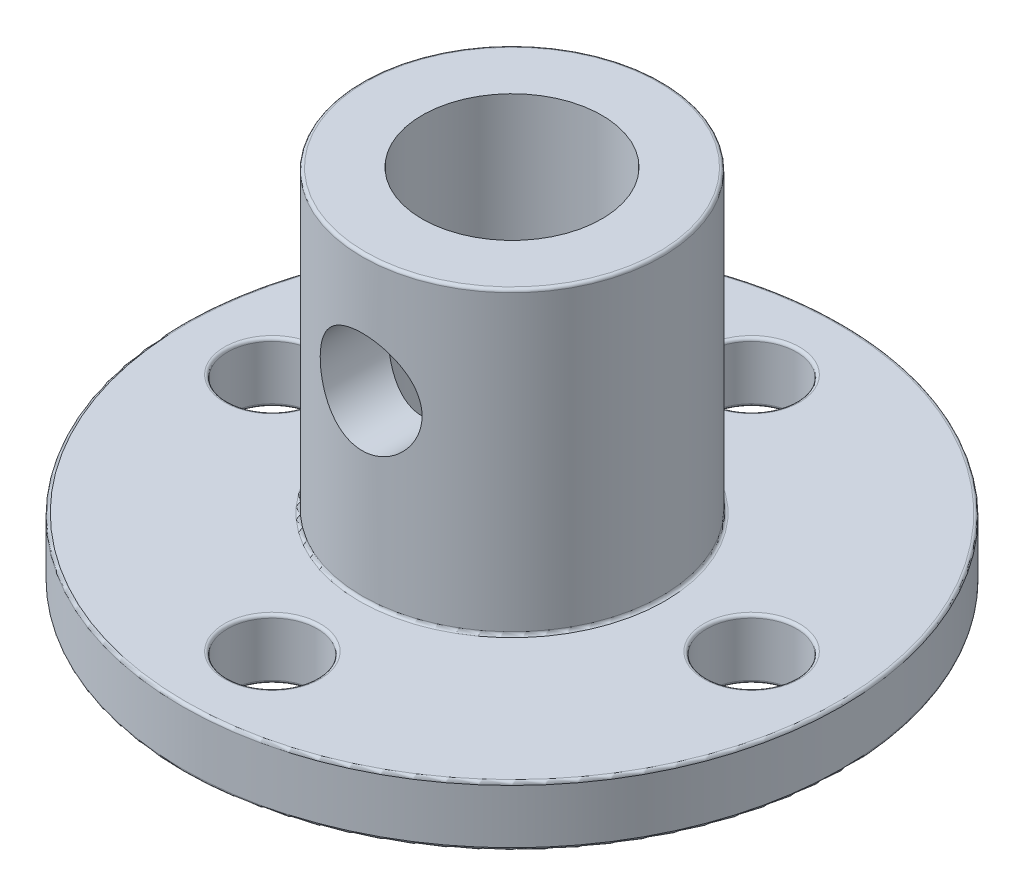
from build123d import *

# Parameters (mm, degrees)
SKETCH2_R                 = 11
BOSS_EXTRUDE1_DEPTH       = 2
SKETCH3_R                 = 5
BOSS_EXTRUDE2_DEPTH       = 10
SKETCH4_R                 = 3
CUT_EXTRUDE1_DEPTH        = 20.646882704
SKETCH5_R                 = 1.5
CUT_EXTRUDE2_DEPTH        = 19.493242009
FILLET1_R                 = 0.1
M3_CLEARANCE_HOLE1_REACH  = 24.825
M3_CLEARANCE_HOLE1_BORE_R = 1.7


with BuildPart() as part:
    # Sketch2 → Boss-Extrude1 (new body)
    with BuildSketch(Plane(origin=(0, 0, 0), x_dir=(1, 0, 0), z_dir=(0, 1, 0))):
        with Locations(Location((0, 0, 0), (0, 0, 270))):
            Circle(SKETCH2_R)
    extrude(amount=BOSS_EXTRUDE1_DEPTH)

    # Sketch3 → Boss-Extrude2 (add)
    with BuildSketch(Plane(origin=(0, 2, 0), x_dir=(1, 0, 0), z_dir=(0, 1, 0))):
        with Locations(Location((0, 0, 0), (0, 0, 270))):
            Circle(SKETCH3_R)
    extrude(amount=BOSS_EXTRUDE2_DEPTH)

    # Sketch4 → Cut-Extrude1 (cut, through all)
    with BuildSketch(Plane(origin=(0, 12, 0), x_dir=(1, 0, 0), z_dir=(0, 1, 0))):
        with Locations(Location((0, 0, 0), (0, 0, 270))):
            Circle(SKETCH4_R)
    extrude(amount=-CUT_EXTRUDE1_DEPTH, mode=Mode.SUBTRACT)

    # Sketch5 → Cut-Extrude2 (cut, through all)
    with BuildSketch(Plane(origin=(0, 2, 0), x_dir=(1, 0, 0), z_dir=(0, 1, 0))):
        with Locations(Location((0, -8, 0), (0, 0, 270))):
            Circle(SKETCH5_R)
        with Locations(Location((-8, 0, 0), (0, 0, 270))):
            Circle(SKETCH5_R)
        with Locations(Location((0, 8, 0), (0, 0, 270))):
            Circle(SKETCH5_R)
        with Locations(Location((8, 0, 0), (0, 0, 270))):
            Circle(SKETCH5_R)
    extrude(amount=-CUT_EXTRUDE2_DEPTH, mode=Mode.SUBTRACT)

    # Fillet1
    fillet1_edges = [part.edges().sort_by_distance(p)[0] for p in [
        (0, 0, 6.5),
        (0, 2, 6.5),
        (0, 0, -11),
        (-8, 0, -1.5),
        (-8, 2, -1.5),
        (0, 0, -9.5),
        (0, 2, -9.5),
        (8, 0, -1.5),
        (8, 2, -1.5),
        (0, 2, -11),
        (0, 2, -5),
        (0, 12, -5),
    ]]
    fillet(fillet1_edges, radius=FILLET1_R)

    # M3 Clearance Hole1 bore → M3 Clearance Hole1 (cut, up to next)
    with BuildSketch(Plane.XY.offset(5), mode=Mode.PRIVATE) as m3_clearance_hole1_sk1:
        with Locations((0, 8)):
            Circle(M3_CLEARANCE_HOLE1_BORE_R)
    m3_clearance_hole1_tool1 = extrude(m3_clearance_hole1_sk1.sketch, amount=-M3_CLEARANCE_HOLE1_REACH, mode=Mode.PRIVATE) & part.part
    add(m3_clearance_hole1_tool1.solids().sort_by_distance((0, 8, 5))[0], mode=Mode.SUBTRACT)


solid = part.part
